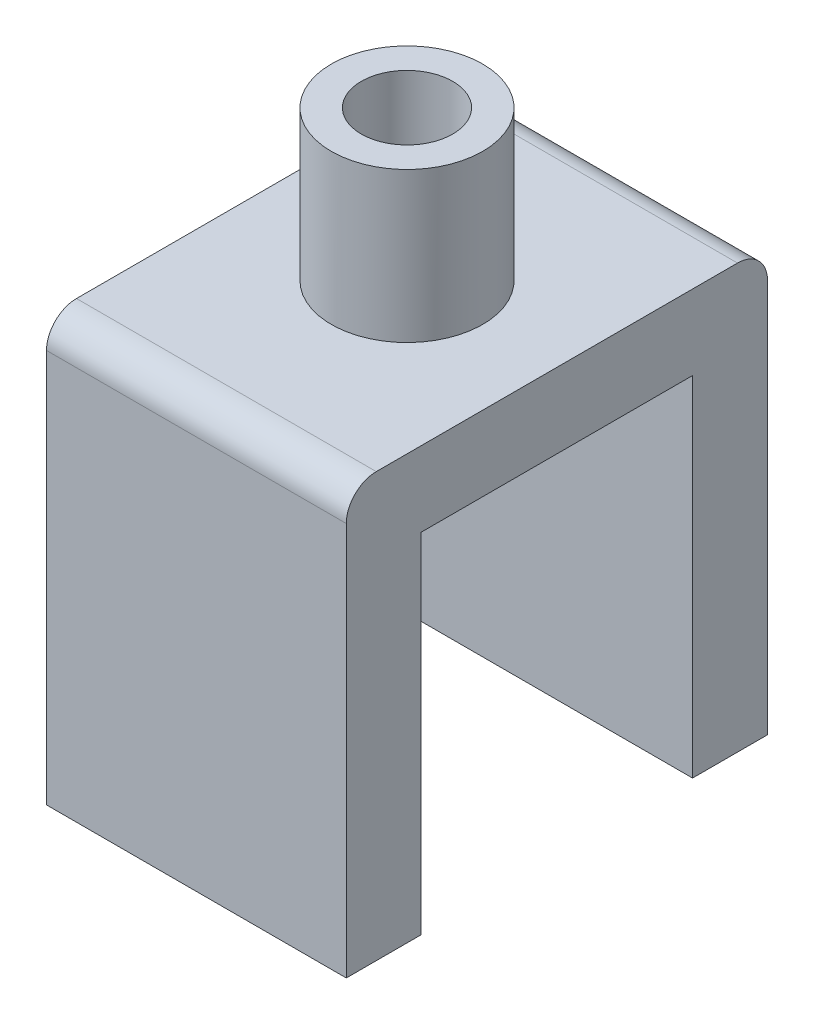
from build123d import *

# Parameters (mm, degrees)
SALIENTE_EXTRUIR1_DEPTH = 10
CROQUIS2_R              = 3.05
CORTAR_EXTRUIR1_DEPTH   = 34.103958495
SALIENTE_EXTRUIR2_START = 10
CROQUIS3_R              = 5.05
CROQUIS3_R_2            = 3.05
SALIENTE_EXTRUIR2_DEPTH = 10


with BuildPart() as part:
    # Croquis1 → Saliente-Extruir1 (new, symmetric)
    with BuildSketch(Plane(origin=(0, 0, 0), x_dir=(0, 0, -1), z_dir=(1, 0, 0))):
        with BuildLine():
            Line((-9.05, 0), (9.05, 0))
            Line((9.05, 0), (9.05, -23.257203825))
            Line((9.05, -23.257203825), (14.05, -23.257203825))
            Line((14.05, -23.257203825), (14.05, 3))
            ThreePointArc((14.05, 3), (13.464213562, 4.414213562), (12.05, 5))
            Line((12.05, 5), (-12.05, 5))
            ThreePointArc((-12.05, 5), (-13.464213562, 4.414213562), (-14.05, 3))
            Line((-14.05, 3), (-14.05, -23.257203825))
            Line((-14.05, -23.257203825), (-9.05, -23.257203825))
            Line((-9.05, -23.257203825), (-9.05, 0))
        make_face()
    extrude(amount=SALIENTE_EXTRUIR1_DEPTH, both=True)

    # Croquis2 → Cortar-Extruir1 (cut, through all)
    with BuildSketch(Plane(origin=(0, 5, 0), x_dir=(1, 0, 0), z_dir=(0, 1, 0))):
        with Locations(Location((0, 0, 0), (0, 0, 270))):
            Circle(CROQUIS2_R)
    extrude(amount=-CORTAR_EXTRUIR1_DEPTH, mode=Mode.SUBTRACT)

    # Croquis3 → Saliente-Extruir2 (add)
    with BuildSketch(Plane(origin=(0, 5, 0), x_dir=(1, 0, 0), z_dir=(0, 1, 0)).offset(SALIENTE_EXTRUIR2_START)):
        with Locations(Location((0, 0, 0), (0, 0, 90))):
            Circle(CROQUIS3_R)
        with Locations(Location((0, 0, 0), (0, 0, 270))):
            Circle(CROQUIS3_R_2, mode=Mode.SUBTRACT)
    extrude(amount=-SALIENTE_EXTRUIR2_DEPTH)


solid = part.part
